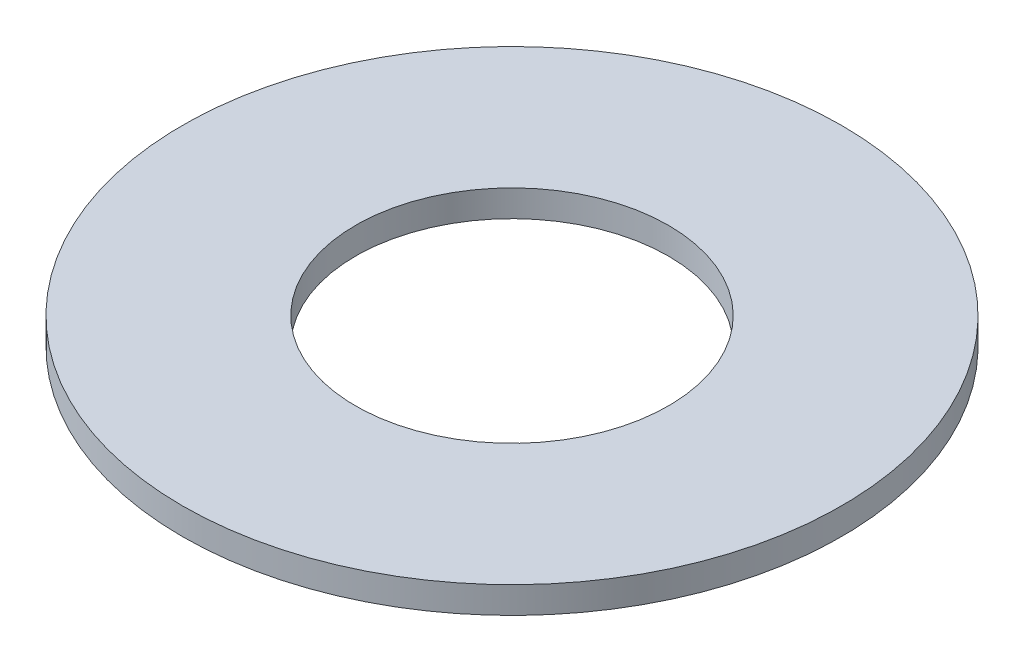
from build123d import *

# Parameters (mm, degrees)
SKETCH1_R           = 12.36
BOSS_EXTRUDE1_DEPTH = 1
SKETCH2_R           = 5.8674
CUT_EXTRUDE1_DEPTH  = 18.508260907


with BuildPart() as part:
    # Sketch1 → Boss-Extrude1 (new body)
    with BuildSketch(Plane(origin=(0, 0, 0), x_dir=(1, 0, 0), z_dir=(0, 1, 0))):
        with Locations(Location((0, 0, 0), (0, 0, 270))):
            Circle(SKETCH1_R)
    extrude(amount=BOSS_EXTRUDE1_DEPTH)

    # Sketch2 → Cut-Extrude1 (cut, through all)
    with BuildSketch(Plane(origin=(0, 0, 0), x_dir=(-1, 0, 0), z_dir=(0, -1, 0))):
        with Locations(Location((0, 0, 0), (0, 0, 90))):
            Circle(SKETCH2_R)
    extrude(amount=-CUT_EXTRUDE1_DEPTH, mode=Mode.SUBTRACT)


solid = part.part
